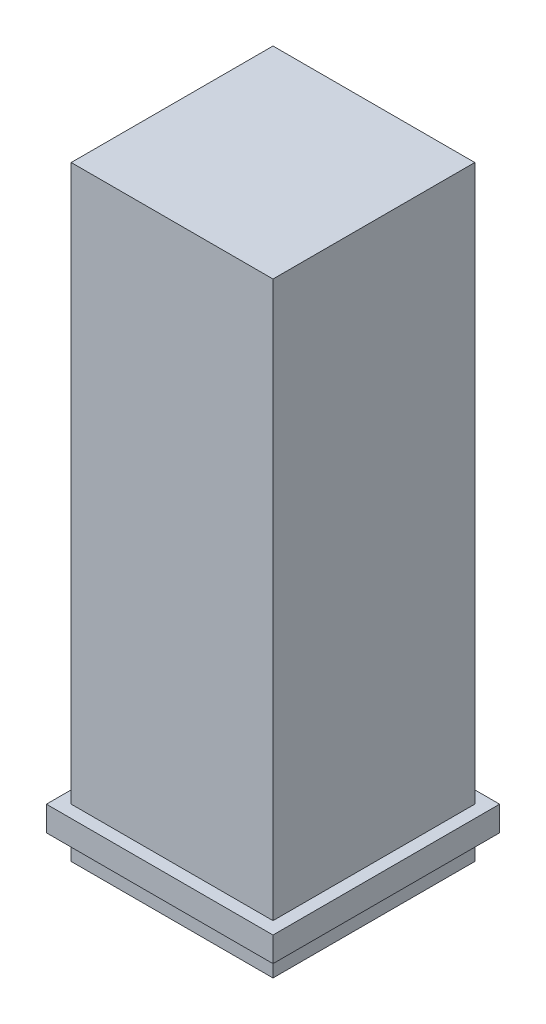
from build123d import *

# Parameters (mm, degrees)
SKETCH2_W           = 812.8
SKETCH2_H           = 812.8
BOSS_EXTRUDE1_DEPTH = 2438.4
SKETCH3_W           = 912.8
SKETCH3_H           = 912.8
SKETCH3_W_2         = 812.8
SKETCH3_H_2         = 812.8
BOSS_EXTRUDE2_DEPTH = 100


with BuildPart() as part:
    # Sketch2 → Boss-Extrude1 (new body)
    with BuildSketch(Plane(origin=(0, 0, 0), x_dir=(1, 0, 0), z_dir=(0, 1, 0))):
        with Locations((406.4, 406.4)):
            Rectangle(SKETCH2_W, SKETCH2_H)
    extrude(amount=BOSS_EXTRUDE1_DEPTH)

    # Sketch3 → Boss-Extrude2 (add)
    with BuildSketch(Plane(origin=(0, 100, 0), x_dir=(1, 0, 0), z_dir=(0, 1, 0))):
        with Locations((406.4, 406.4)):
            Rectangle(SKETCH3_W, SKETCH3_H)
        with Locations((406.4, 406.4)):
            Rectangle(SKETCH3_W_2, SKETCH3_H_2, mode=Mode.SUBTRACT)
    extrude(amount=BOSS_EXTRUDE2_DEPTH)


solid = part.part
